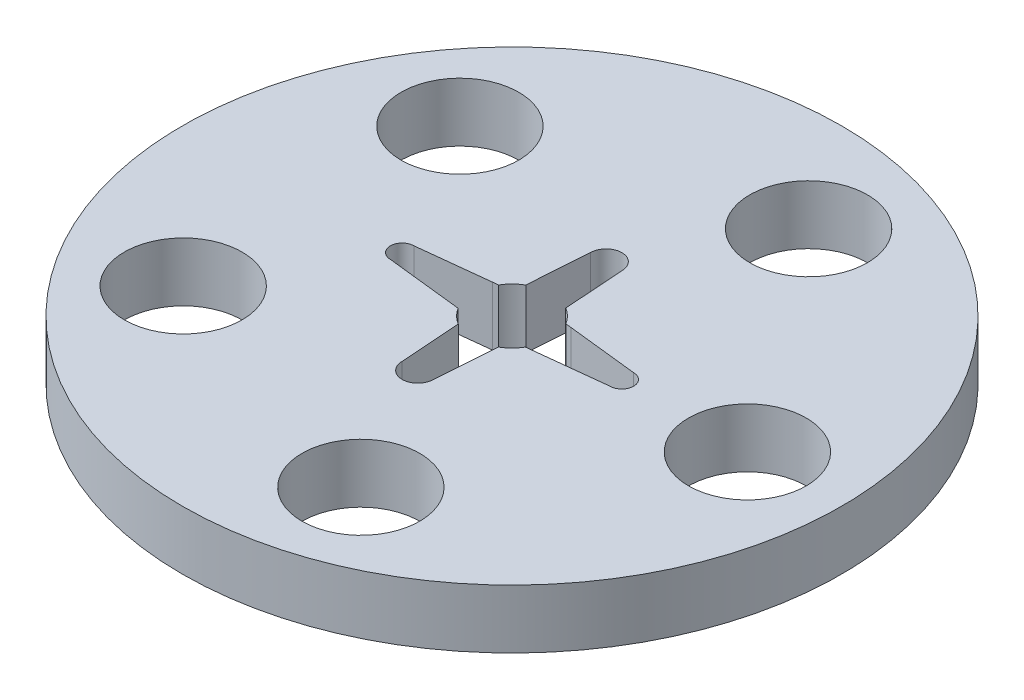
from build123d import *

# Parameters (mm, degrees)
SKETCH1_R           = 42
SKETCH1_R_2         = 7.5
BOSS_EXTRUDE2_DEPTH = 7.5


with BuildPart() as part:
    # Sketch1 → Boss-Extrude2 (new body)
    with BuildSketch(Plane(origin=(0, 0, 0), x_dir=(1, 0, 0), z_dir=(0, 1, 0))):
        with Locations(Location((0, 0, 0), (0, 0, 270))):
            Circle(SKETCH1_R)
        with Locations(Location((30, 0, 0), (0, 0, 270))):
            Circle(SKETCH1_R_2, mode=Mode.SUBTRACT)
        with Locations(Location((9.270509831, -28.531695489, 0), (0, 0, 270))):
            Circle(SKETCH1_R_2, mode=Mode.SUBTRACT)
        with Locations(Location((-24.270509831, -17.633557569, 0), (0, 0, 270))):
            Circle(SKETCH1_R_2, mode=Mode.SUBTRACT)
        with Locations(Location((-24.270509831, 17.633557569, 0), (0, 0, 270))):
            Circle(SKETCH1_R_2, mode=Mode.SUBTRACT)
        with Locations(Location((9.270509831, 28.531695489, 0), (0, 0, 270))):
            Circle(SKETCH1_R_2, mode=Mode.SUBTRACT)
        with BuildLine():
            Line((4.999698513, -2.497254635), (4.285172416, -2.575710114))
            ThreePointArc((4.285172416, -2.575710114), (3.523319938, -3.547280908), (2.546607961, -4.302531013))
            Line((2.546607961, -4.302531013), (2.497527986, -4.99999802))
            Line((2.497527986, -4.99999802), (2, -12))
            ThreePointArc((2, -12), (0, -14), (-2, -12))
            Line((-2, -12), (-2.496981283, -4.99999802))
            Line((-2.496981283, -4.99999802), (-2.546494806, -4.302597986))
            ThreePointArc((-2.546494806, -4.302597986), (-3.523273292, -3.547327238), (-4.285172416, -2.575710114))
            Line((-4.285172416, -2.575710114), (-4.999698513, -2.497254635))
            Line((-4.999698513, -2.497254635), (-14, -1.5))
            ThreePointArc((-14, -1.5), (-15.5, 0), (-14, 1.5))
            Line((-14, 1.5), (-4.999698513, 2.497254635))
            Line((-4.999698513, 2.497254635), (-4.285172416, 2.575710114))
            ThreePointArc((-4.285172416, 2.575710114), (-3.523273292, 3.547327238), (-2.546494806, 4.302597986))
            Line((-2.546494806, 4.302597986), (-2.496981283, 4.99999802))
            Line((-2.496981283, 4.99999802), (-2, 12))
            ThreePointArc((-2, 12), (0, 14), (2, 12))
            Line((2, 12), (2.497527986, 4.99999802))
            Line((2.497527986, 4.99999802), (2.546607961, 4.302531013))
            ThreePointArc((2.546607961, 4.302531013), (3.523319938, 3.547280908), (4.285172416, 2.575710114))
            Line((4.285172416, 2.575710114), (4.999698513, 2.497254635))
            Line((4.999698513, 2.497254635), (14, 1.5))
            ThreePointArc((14, 1.5), (15.5, 0), (14, -1.5))
            Line((14, -1.5), (4.999698513, -2.497254635))
        make_face(mode=Mode.SUBTRACT)
    extrude(amount=BOSS_EXTRUDE2_DEPTH)


solid = part.part
